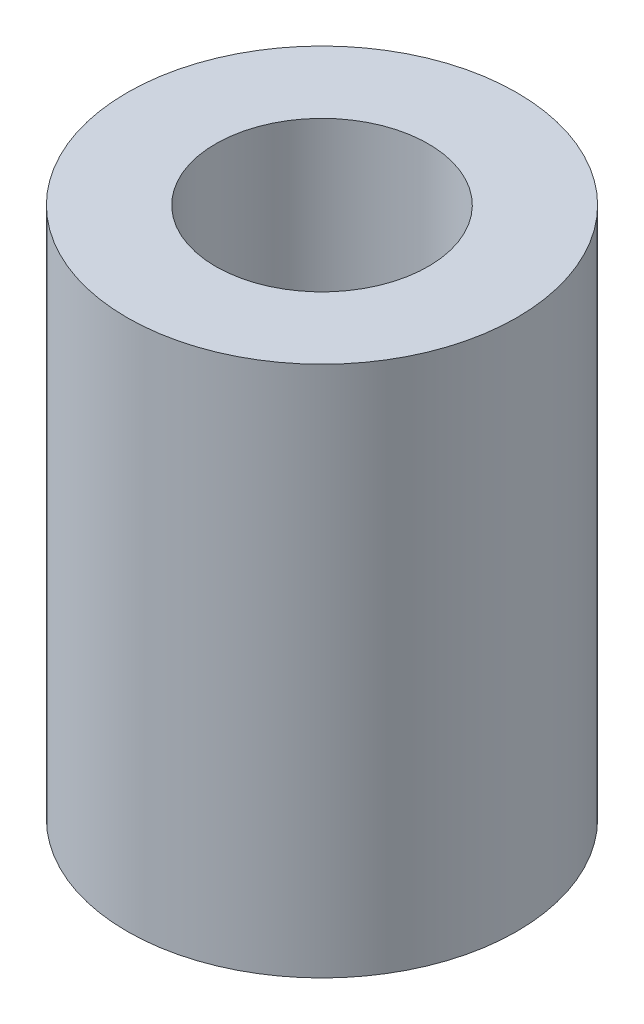
from build123d import *

# Parameters (mm, degrees)
SKETCH_1_R      = 11
SKETCH_1_R_2    = 6
EXTRUDE_1_DEPTH = 30


with BuildPart() as part:
    # 草图1 → 凸台-拉伸1 (new body)
    with BuildSketch(Plane(origin=(0, 0, 0), x_dir=(1, 0, 0), z_dir=(0, 1, 0))):
        with Locations(Location((0, 0, 0), (0, 0, 270))):
            Circle(SKETCH_1_R)
        with Locations(Location((0, 0, 0), (0, 0, 270))):
            Circle(SKETCH_1_R_2, mode=Mode.SUBTRACT)
    extrude(amount=EXTRUDE_1_DEPTH)


solid = part.part
